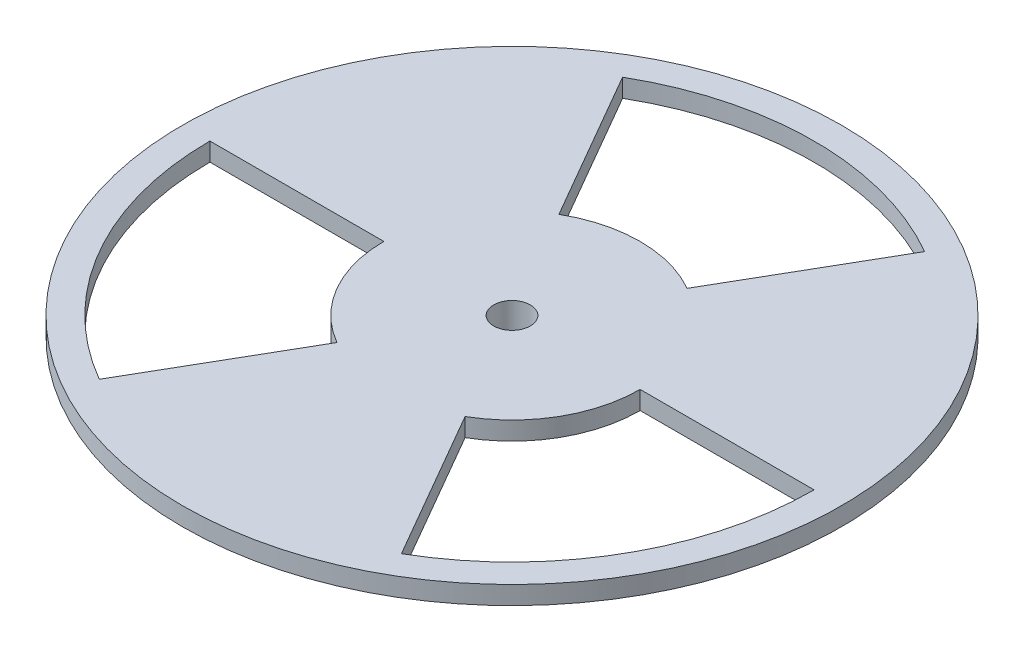
from build123d import *

# Parameters (mm, degrees)
SKETCH1_R           = 18
BOSS_EXTRUDE1_DEPTH = 1
SKETCH2_R           = 2
BOSS_EXTRUDE2_DEPTH = 2
SKETCH3_R           = 1
CUT_EXTRUDE1_DEPTH  = 26.632011236
CUT_EXTRUDE2_REACH  = 27.632


with BuildPart() as part:
    # Sketch1 → Boss-Extrude1 (new body)
    with BuildSketch(Plane(origin=(0, 0, 0), x_dir=(1, 0, 0), z_dir=(0, 1, 0))):
        with Locations(Location((0, 0, 0), (0, 0, 270))):
            Circle(SKETCH1_R)
    extrude(amount=BOSS_EXTRUDE1_DEPTH)

    # Sketch2 → Boss-Extrude2 (add)
    with BuildSketch(Plane.XZ):
        with Locations(Location((0, 0, 0), (0, 0, 90))):
            Circle(SKETCH2_R)
    extrude(amount=BOSS_EXTRUDE2_DEPTH)

    # Sketch3 → Cut-Extrude1 (cut, through all)
    with BuildSketch(Plane.XZ.offset(2)):
        with Locations(Location((0, 0, 0), (0, 0, 270))):
            Circle(SKETCH3_R)
    extrude(amount=-CUT_EXTRUDE1_DEPTH, mode=Mode.SUBTRACT)

    # Sketch4 → Cut-Extrude2 (cut, up to next)
    with BuildSketch(Plane(origin=(0, 1, 0), x_dir=(1, 0, 0), z_dir=(0, 1, 0)), mode=Mode.PRIVATE) as cut_extrude2_sk1:
        with BuildLine():
            Line((-3.5, 6.062177826), (-8.25, 14.289419162))
            ThreePointArc((-8.25, 14.289419162), (0, 16.5), (8.25, 14.289419162))
            Line((8.25, 14.289419162), (3.5, 6.062177826))
            ThreePointArc((3.5, 6.062177826), (0, 7), (-3.5, 6.062177826))
        make_face()
    cut_extrude2_tool1 = extrude(cut_extrude2_sk1.sketch, amount=-CUT_EXTRUDE2_REACH, mode=Mode.PRIVATE) & part.part
    # Sketch4 → Cut-Extrude2 (cut, up to next)
    with BuildSketch(Plane(origin=(0, 1, 0), x_dir=(1, 0, 0), z_dir=(0, 1, 0)), mode=Mode.PRIVATE) as cut_extrude2_sk2:
        with BuildLine():
            Line((7, 0), (16.5, 0))
            ThreePointArc((16.5, 0), (14.289419162, -8.25), (8.25, -14.289419162))
            Line((8.25, -14.289419162), (3.5, -6.062177826))
            ThreePointArc((3.5, -6.062177826), (6.062177826, -3.5), (7, 0))
        make_face()
    cut_extrude2_tool2 = extrude(cut_extrude2_sk2.sketch, amount=-CUT_EXTRUDE2_REACH, mode=Mode.PRIVATE) & part.part
    # Sketch4 → Cut-Extrude2 (cut, up to next)
    with BuildSketch(Plane(origin=(0, 1, 0), x_dir=(1, 0, 0), z_dir=(0, 1, 0)), mode=Mode.PRIVATE) as cut_extrude2_sk3:
        with BuildLine():
            Line((-3.5, -6.062177826), (-8.25, -14.289419162))
            ThreePointArc((-8.25, -14.289419162), (-14.289419162, -8.25), (-16.5, 0))
            Line((-16.5, 0), (-7, 0))
            ThreePointArc((-7, 0), (-6.062177826, -3.5), (-3.5, -6.062177826))
        make_face()
    cut_extrude2_tool3 = extrude(cut_extrude2_sk3.sketch, amount=-CUT_EXTRUDE2_REACH, mode=Mode.PRIVATE) & part.part
    add(cut_extrude2_tool1.solids().sort_by_distance((0, 1, -11.831646))[0], mode=Mode.SUBTRACT)
    add(cut_extrude2_tool2.solids().sort_by_distance((10.246506, 1, 5.915823))[0], mode=Mode.SUBTRACT)
    add(cut_extrude2_tool3.solids().sort_by_distance((-10.246506, 1, 5.915823))[0], mode=Mode.SUBTRACT)


solid = part.part
